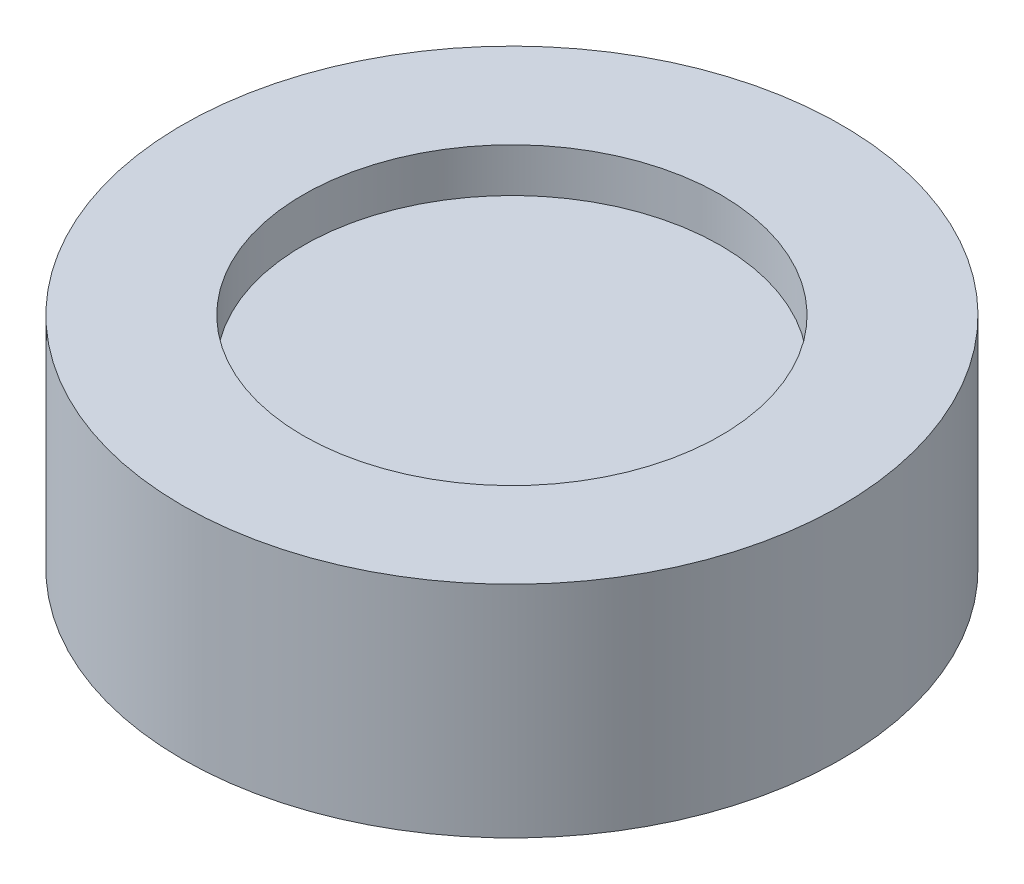
from build123d import *

# Parameters (mm, degrees)
SKETCH1_R           = 38.1
BOSS_EXTRUDE1_DEPTH = 12.7
SKETCH2_R           = 24.13
CUT_EXTRUDE1_DEPTH  = 5.08


with BuildPart() as part:
    # Sketch1 → Boss-Extrude1 (new body)
    with BuildSketch(Plane(origin=(0, 0, 0), x_dir=(1, 0, 0), z_dir=(0, 1, 0))):
        with Locations(Location((0, 0, 0), (0, 0, 270))):
            Circle(SKETCH1_R)
    boss_extrude1 = extrude(amount=BOSS_EXTRUDE1_DEPTH)

    # Sketch2 → Cut-Extrude1 (cut)
    with BuildSketch(Plane(origin=(0, 12.7, 0), x_dir=(1, 0, 0), z_dir=(0, 1, 0))):
        with Locations(Location((0, 0, 0), (0, 0, 270))):
            Circle(SKETCH2_R)
    cut_extrude1 = extrude(amount=-CUT_EXTRUDE1_DEPTH, mode=Mode.SUBTRACT)

    # Mirror1: Boss-Extrude1, Cut-Extrude1 across plane
    add(boss_extrude1.mirror(Plane.ZX))
    add(cut_extrude1.mirror(Plane.ZX), mode=Mode.SUBTRACT)


solid = part.part
